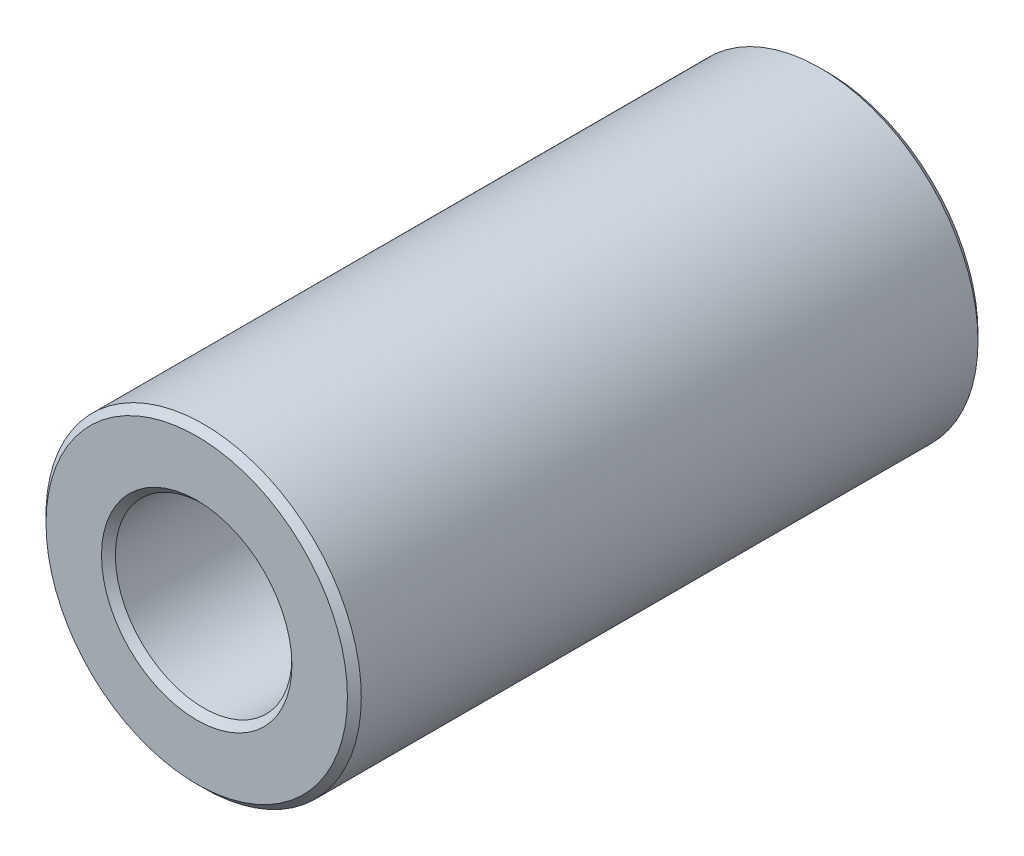
from build123d import *

# Parameters (mm, degrees)
BOSS_EXTRUDE1_DEPTH      = 6.35
BOSS_EXTRUDE1_DEPTH_BACK = 6.35
SKETCH3_R                = 3.175
SKETCH3_R_2              = 1.778
CHAMFER1_SIZE            = 0.1397


with BuildPart() as part:
    # Sketch3 → Boss-Extrude1 (new, two sides: drawn at the far end of the back side and taken through both)
    with BuildSketch(Plane.XY.offset(-BOSS_EXTRUDE1_DEPTH_BACK)):
        Circle(SKETCH3_R)
        Circle(SKETCH3_R_2, mode=Mode.SUBTRACT)
    extrude(amount=BOSS_EXTRUDE1_DEPTH + BOSS_EXTRUDE1_DEPTH_BACK)

    # Chamfer1
    chamfer1_edges = [part.edges().sort_by_distance(p)[0] for p in [
        (-3.175, 0, -6.35),
        (-1.778, 0, -6.35),
        (-3.175, 0, 6.35),
        (-1.778, 0, 6.35),
    ]]
    chamfer(chamfer1_edges, length=CHAMFER1_SIZE)


solid = part.part
